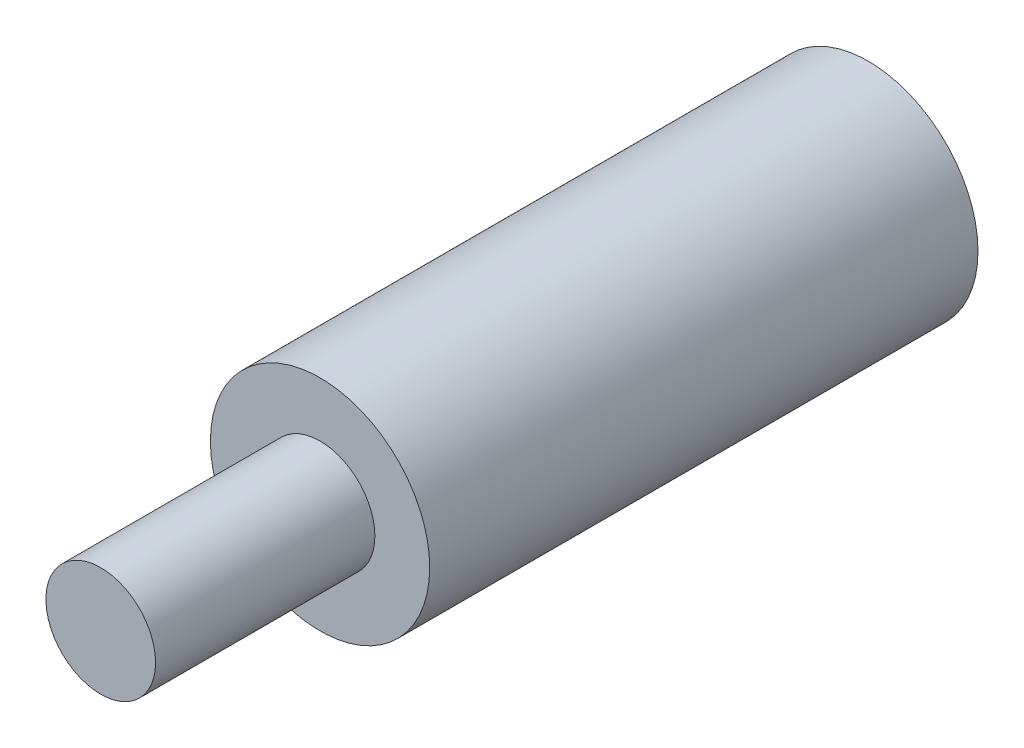
from build123d import *

# Parameters (mm, degrees)
SKETCH_1_R      = 3
SKETCH_1_R_2    = 1.5
EXTRUDE_1_DEPTH = 15
SKETCH_2_R      = 1.5
EXTRUDE_2_DEPTH = 6


with BuildPart() as part:
    # 草图1 → 凸台-拉伸1 (new body)
    with BuildSketch(Plane.XY):
        Circle(SKETCH_1_R)
        Circle(SKETCH_1_R_2, mode=Mode.SUBTRACT)
    extrude(amount=EXTRUDE_1_DEPTH)


with BuildPart() as body_2:
    # 草图2 → 凸台-拉伸2 (new body)
    with BuildSketch(Plane.XY.offset(15)):
        Circle(SKETCH_2_R)
    extrude(amount=EXTRUDE_2_DEPTH)


solid = Compound([part.part, body_2.part])
